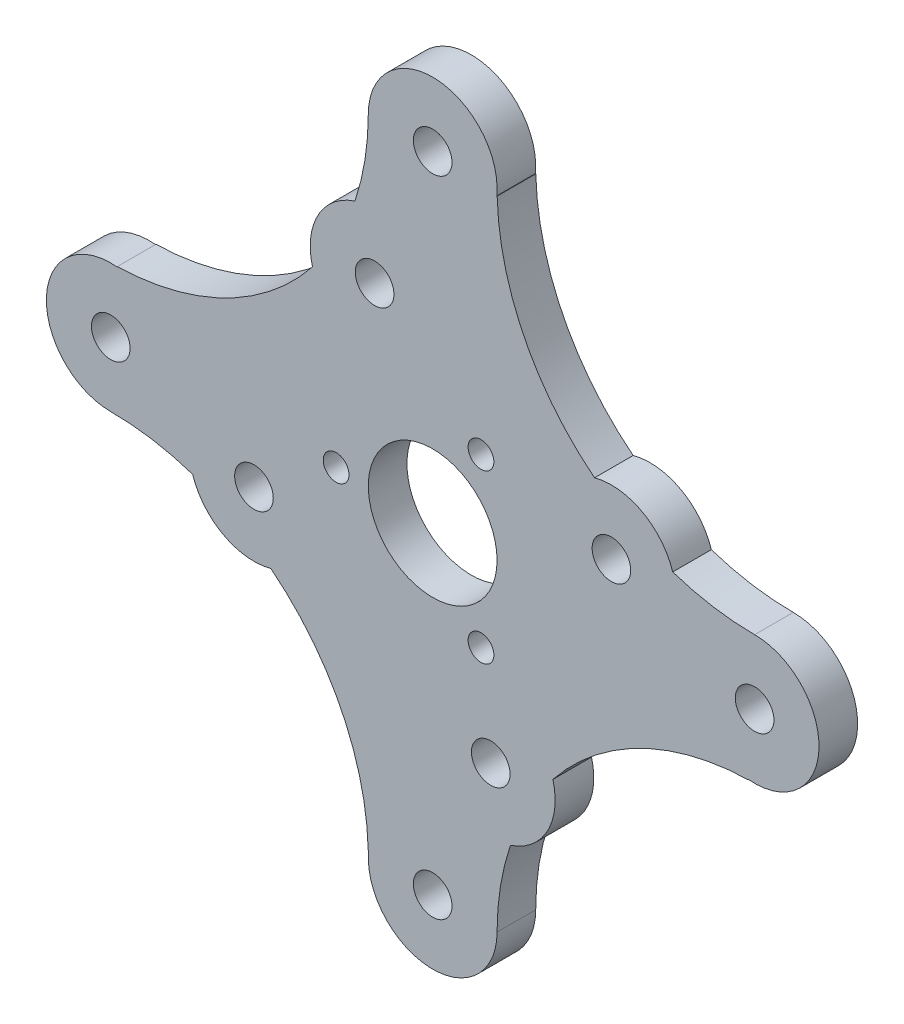
from build123d import *

# Parameters (mm, degrees)
CROQUIS1_R              = 1.5
CROQUIS1_R_2            = 5
SALIENTE_EXTRUIR1_DEPTH = 3
CROQUIS2_R              = 1
CORTAR_EXTRUIR2_DEPTH   = 43.532340636


with BuildPart() as part:
    # Croquis1 → Saliente-Extruir1 (new body)
    with BuildSketch(Plane.XY):
        with BuildLine():
            ThreePointArc((-5.006412365, -24.493587635), (-4.990675805, -24.496798873), (-4.974937186, -24.5))
            ThreePointArc((-4.974937186, -24.5), (-0.250313875, -29.993730366), (5, -25))
            ThreePointArc((5, -25), (5.261221354, -21.77810342), (6.038061758, -18.640369658))
            ThreePointArc((6.038061758, -18.640369658), (8.90430573, -16.264636165), (9.334316304, -12.56672391))
            ThreePointArc((9.334316304, -12.56672391), (16.073984628, -7.10233955), (24.493587635, -5.006412365))
            ThreePointArc((24.493587635, -5.006412365), (24.496798873, -4.990675805), (24.5, -4.974937186))
            ThreePointArc((24.5, -4.974937186), (29.993730366, -0.250313875), (25, 5))
            ThreePointArc((25, 5), (21.77810342, 5.261221354), (18.640369658, 6.038061758))
            ThreePointArc((18.640369658, 6.038061758), (16.264636165, 8.90430573), (12.56672391, 9.334316304))
            ThreePointArc((12.56672391, 9.334316304), (7.10233955, 16.073984628), (5.006412365, 24.493587635))
            ThreePointArc((5.006412365, 24.493587635), (4.990675805, 24.496798873), (4.974937186, 24.5))
            ThreePointArc((4.974937186, 24.5), (0.250313875, 29.993730366), (-5, 25))
            ThreePointArc((-5, 25), (-5.261221354, 21.77810342), (-6.038061758, 18.640369658))
            ThreePointArc((-6.038061758, 18.640369658), (-8.90430573, 16.264636165), (-9.334316304, 12.56672391))
            ThreePointArc((-9.334316304, 12.56672391), (-16.073984628, 7.10233955), (-24.493587635, 5.006412365))
            ThreePointArc((-24.493587635, 5.006412365), (-24.496798873, 4.990675805), (-24.5, 4.974937186))
            ThreePointArc((-24.5, 4.974937186), (-29.993730366, 0.250313875), (-25, -5))
            ThreePointArc((-25, -5), (-21.77810342, -5.261221354), (-18.640369658, -6.038061758))
            ThreePointArc((-18.640369658, -6.038061758), (-16.264636165, -8.90430573), (-12.56672391, -9.334316304))
            ThreePointArc((-12.56672391, -9.334316304), (-7.10233955, -16.073984628), (-5.006412365, -24.493587635))
        make_face()
        with Locations((-25, 0)):
            Circle(CROQUIS1_R, mode=Mode.SUBTRACT)
        with Locations((0, -25)):
            Circle(CROQUIS1_R, mode=Mode.SUBTRACT)
        with Locations((4.50977544, -13.879661629)):
            Circle(CROQUIS1_R, mode=Mode.SUBTRACT)
        with Locations((0, 25)):
            Circle(CROQUIS1_R, mode=Mode.SUBTRACT)
        with Locations((13.879661629, 4.50977544)):
            Circle(CROQUIS1_R, mode=Mode.SUBTRACT)
        with Locations((25, 0)):
            Circle(CROQUIS1_R, mode=Mode.SUBTRACT)
        with Locations((-4.50977544, 13.879661629)):
            Circle(CROQUIS1_R, mode=Mode.SUBTRACT)
        with Locations((-13.879661629, -4.50977544)):
            Circle(CROQUIS1_R, mode=Mode.SUBTRACT)
        Circle(CROQUIS1_R_2, mode=Mode.SUBTRACT)
    extrude(amount=SALIENTE_EXTRUIR1_DEPTH)

    # Croquis2 → Cortar-Extruir2 (cut, through all)
    with BuildSketch(Plane.XY.offset(3)):
        with Locations((3.75, 6.495190528)):
            Circle(CROQUIS2_R)
        with Locations((3.75, -6.495190528)):
            Circle(CROQUIS2_R)
        with Locations((-7.5, 0)):
            Circle(CROQUIS2_R)
    extrude(amount=-CORTAR_EXTRUIR2_DEPTH, mode=Mode.SUBTRACT)


solid = part.part
